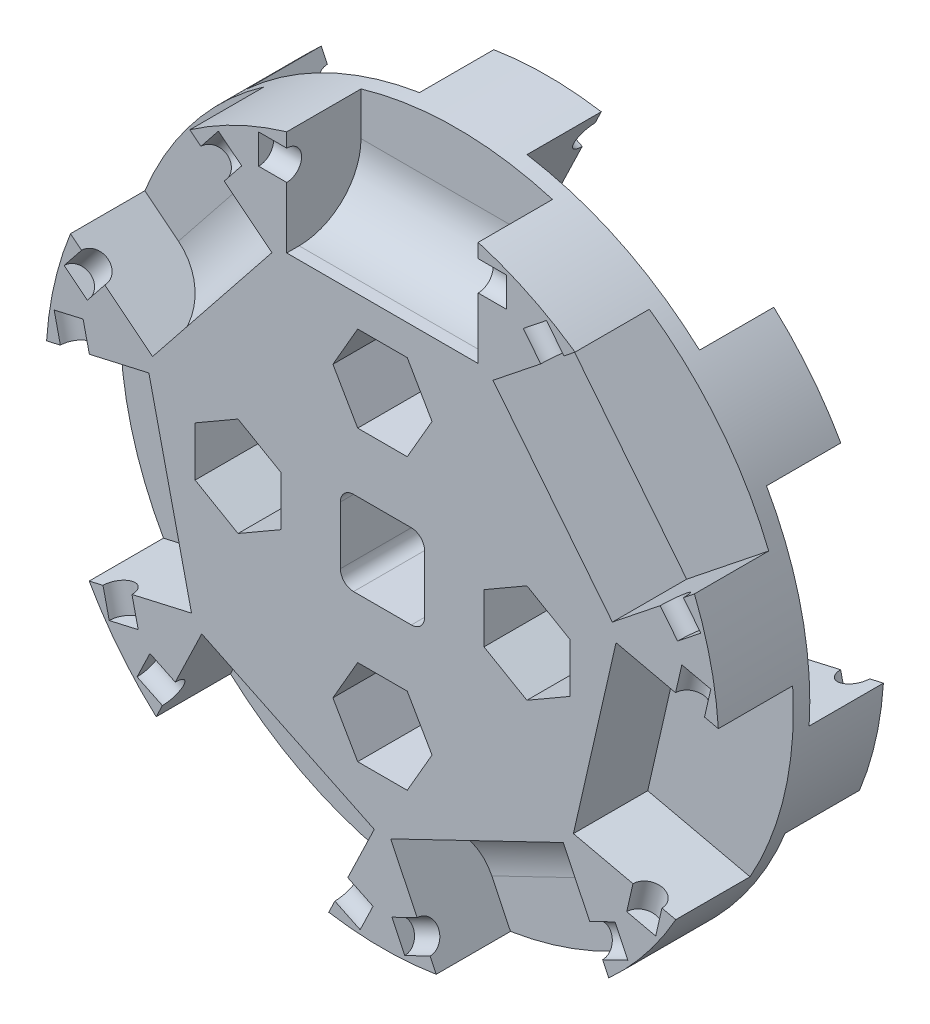
from build123d import *

# Parameters (mm, degrees)
SKETCH1_R           = 25.8953
BOSS_EXTRUDE2_DEPTH = 6.35
SKETCH2_W           = 14.732
SKETCH2_H           = 10.414
CUT_EXTRUDE2_DEPTH  = 5.715
CIRPATTERN1_COUNT   = 7
SKETCH4_R           = 1.143
CUT_EXTRUDE4_DEPTH  = 9.525
CIRPATTERN2_COUNT   = 7
SKETCH5_W           = 6.477
SKETCH5_H           = 6.477
CUT_EXTRUDE5_DEPTH  = 38.167938121
CUT_EXTRUDE7_DEPTH  = 38.167938121
SKETCH9_R           = 25.8953
SKETCH9_W           = 6.477
SKETCH9_H           = 6.477
BOSS_EXTRUDE3_DEPTH = 6.35
CUT_EXTRUDE8_DEPTH  = 5.715
CIRPATTERN3_COUNT   = 7
SKETCH11_R          = 1.143
CUT_EXTRUDE9_DEPTH  = 9.525
CIRPATTERN4_COUNT   = 7
FILLET1_R           = 4.7625
FILLET2_R           = 1.016


with BuildPart() as part:
    # Sketch1 → Boss-Extrude2 (new body)
    with BuildSketch(Plane.XY):
        Circle(SKETCH1_R)
    extrude(amount=-BOSS_EXTRUDE2_DEPTH)

    # Sketch2 → Cut-Extrude2 (cut)
    with BuildSketch(Plane.XY):
        with Locations((0, 21.9583)):
            Rectangle(SKETCH2_W, SKETCH2_H)
    cut_extrude2 = extrude(amount=-CUT_EXTRUDE2_DEPTH, mode=Mode.SUBTRACT)

    # CirPattern1: Cut-Extrude2 ×7 about axis
    cirpattern1_axis = Axis((0, 0, 0), (0, 0, 1))
    for i in range(1, CIRPATTERN1_COUNT):
        add(cut_extrude2.rotate(cirpattern1_axis, i * 360 / CIRPATTERN1_COUNT), mode=Mode.SUBTRACT)

    # Sketch4 → Cut-Extrude4 (cut, symmetric)
    with BuildSketch(Plane(origin=(0, 0, 0), x_dir=(0, 0, -1), z_dir=(1, 0, 0))):
        with Locations((0, 22.5933)):
            Circle(SKETCH4_R)
    cut_extrude4 = extrude(amount=CUT_EXTRUDE4_DEPTH, both=True, mode=Mode.SUBTRACT)

    # CirPattern2: Cut-Extrude4 ×7 about axis
    cirpattern2_axis = Axis((0, 0, 0), (0, 0, 1))
    for i in range(1, CIRPATTERN2_COUNT):
        add(cut_extrude4.rotate(cirpattern2_axis, i * 360 / CIRPATTERN2_COUNT), mode=Mode.SUBTRACT)

    # Sketch5 → Cut-Extrude5 (cut, through all)
    with BuildSketch(Plane.XY):
        Rectangle(SKETCH5_W, SKETCH5_H)
    extrude(amount=-CUT_EXTRUDE5_DEPTH, mode=Mode.SUBTRACT)

    # Sketch6 → Cut-Extrude7 (cut, through all)
    with BuildSketch(Plane(origin=(0, 0, -6.35), x_dir=(-1, 0, 0), z_dir=(0, 0, -1))):
        Polygon((11.1125, -3.812821178), (14.4145, -1.906410589), (14.4145, 1.906410589), (11.1125, 3.812821178), (7.8105, 1.906410589), (7.8105, -1.906410589), align=None)
        Polygon((3.812821178, 11.1125), (1.906410589, 14.4145), (-1.906410589, 14.4145), (-3.812821178, 11.1125), (-1.906410589, 7.8105), (1.906410589, 7.8105), align=None)
        Polygon((-3.812821178, -11.1125), (-1.906410589, -14.4145), (1.906410589, -14.4145), (3.812821178, -11.1125), (1.906410589, -7.8105), (-1.906410589, -7.8105), align=None)
        Polygon((-11.1125, 3.812821178), (-14.4145, 1.906410589), (-14.4145, -1.906410589), (-11.1125, -3.812821178), (-7.8105, -1.906410589), (-7.8105, 1.906410589), align=None)
    extrude(amount=-CUT_EXTRUDE7_DEPTH, mode=Mode.SUBTRACT)

    # Sketch9 → Boss-Extrude3 (add)
    with BuildSketch(Plane(origin=(0, 0, -6.35), x_dir=(-1, 0, 0), z_dir=(0, 0, -1))):
        with Locations(Location((0, 0, 0), (0, 0, 176.330978548))):
            Circle(SKETCH9_R)
        Rectangle(SKETCH9_W, SKETCH9_H, mode=Mode.SUBTRACT)
        Polygon((11.1125, -3.812821178), (14.4145, -1.906410589), (14.4145, 1.906410589), (11.1125, 3.812821178), (7.8105, 1.906410589), (7.8105, -1.906410589), align=None, mode=Mode.SUBTRACT)
        Polygon((3.812821178, 11.1125), (1.906410589, 14.4145), (-1.906410589, 14.4145), (-3.812821178, 11.1125), (-1.906410589, 7.8105), (1.906410589, 7.8105), align=None, mode=Mode.SUBTRACT)
        Polygon((-3.812821178, -11.1125), (-1.906410589, -14.4145), (1.906410589, -14.4145), (3.812821178, -11.1125), (1.906410589, -7.8105), (-1.906410589, -7.8105), align=None, mode=Mode.SUBTRACT)
        Polygon((-11.1125, 3.812821178), (-14.4145, 1.906410589), (-14.4145, -1.906410589), (-11.1125, -3.812821178), (-7.8105, -1.906410589), (-7.8105, 1.906410589), align=None, mode=Mode.SUBTRACT)
    extrude(amount=BOSS_EXTRUDE3_DEPTH)

    # Sketch10 → Cut-Extrude8 (cut)
    with BuildSketch(Plane(origin=(0, 0, -12.7), x_dir=(-1, 0, 0), z_dir=(0, 0, -1))):
        Polygon((-0.631579998, 18.288387419), (-13.90465336, 11.896412175), (-18.423118619, 21.279101965), (-5.150045257, 27.67107721), align=None)
    cut_extrude8 = extrude(amount=-CUT_EXTRUDE8_DEPTH, mode=Mode.SUBTRACT)

    # CirPattern3: Cut-Extrude8 ×7 about axis
    cirpattern3_axis = Axis((0, 0, 0), (0, 0, 1))
    for i in range(1, CIRPATTERN3_COUNT):
        add(cut_extrude8.rotate(cirpattern3_axis, i * 360 / CIRPATTERN3_COUNT), mode=Mode.SUBTRACT)

    # Sketch11 → Cut-Extrude9 (cut, symmetric)
    with BuildSketch(Plane(origin=(0, 0, 0), x_dir=(0, 0, -1), z_dir=(-0.9009688679024186, 0.43388373911755934, 0))):
        with Locations((12.7, -22.5933)):
            Circle(SKETCH11_R)
    cut_extrude9 = extrude(amount=CUT_EXTRUDE9_DEPTH, both=True, mode=Mode.SUBTRACT)

    # CirPattern4: Cut-Extrude9 ×7 about axis
    cirpattern4_axis = Axis((0, 0, 0), (0, 0, 1))
    for i in range(1, CIRPATTERN4_COUNT):
        add(cut_extrude9.rotate(cirpattern4_axis, i * 360 / CIRPATTERN4_COUNT), mode=Mode.SUBTRACT)

    # Fillet1
    fillet1_edges = [part.edges().sort_by_distance(p)[0] for p in [
        (-13.096693712, 10.444264718, -5.715),
        (0, 16.7513, -5.715),
        (7.268116679, 15.092399797, -6.985),
        (13.096693712, -10.444264718, -6.985),
        (0, -16.7513, -6.985),
        (7.268116679, -15.092399797, -5.715),
        (-13.096693712, -10.444264718, -6.985),
        (16.331309935, 3.727514921, -6.985),
        (-16.331309935, -3.727514921, -5.715),
        (-7.268116679, -15.092399797, -5.715),
    ]]
    fillet(fillet1_edges, radius=FILLET1_R)

    # Fillet2
    fillet2_edges = [part.edges().sort_by_distance(p)[0] for p in [
        (3.2385, 3.2385, -3.175),
        (3.2385, -3.2385, -3.175),
        (-3.2385, -3.2385, -3.175),
        (-3.2385, 3.2385, -3.175),
    ]]
    fillet(fillet2_edges, radius=FILLET2_R)


solid = part.part
